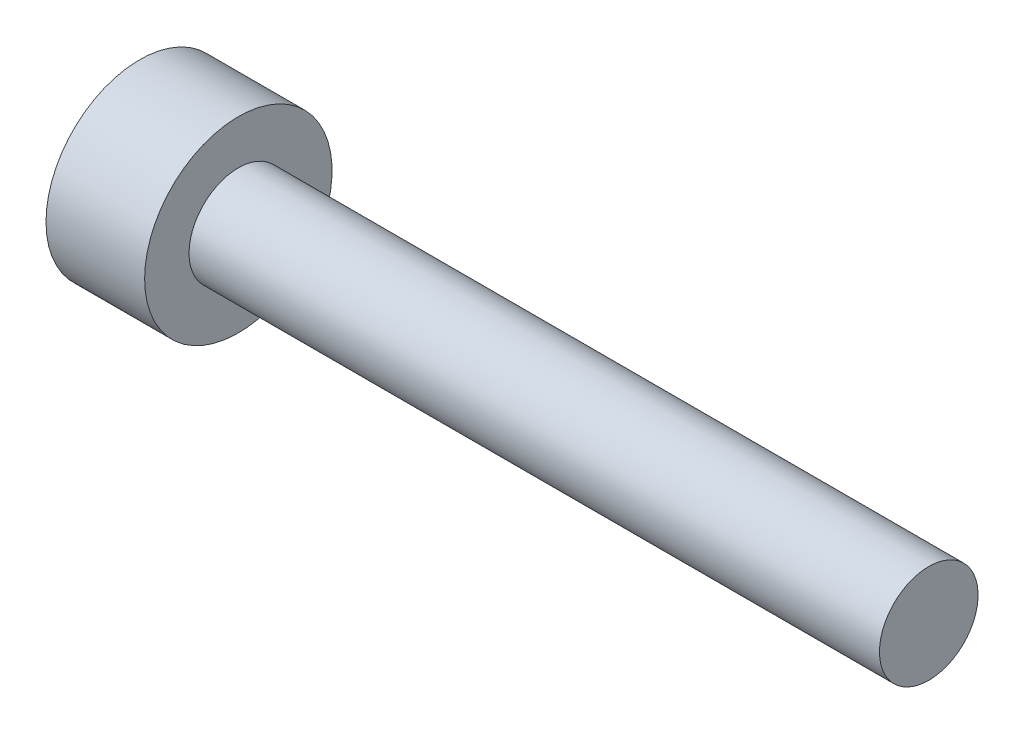
from build123d import *

# Parameters (mm, degrees)
SOCKET_DEPTH = 1


with BuildPart() as part:
    # Screw Sketch → Screw (revolve)
    with BuildSketch(Plane.XY):
        Polygon((-2, 0), (-2, 1.9), (0, 1.9), (0, 1), (14, 1), (14, 0), align=None)
    revolve(axis=Axis((-1000, 0, 0), (1, 0, 0)))

    # Socket Sketch → Socket (cut)
    with BuildSketch(Plane(origin=(-2, 0, 0), x_dir=(0, 0, -1), z_dir=(1, 0, 0))):
        Polygon((0.866025404, 0), (0.433012702, 0.75), (-0.433012702, 0.75), (-0.866025404, 0), (-0.433012702, -0.75), (0.433012702, -0.75), align=None)
    extrude(amount=SOCKET_DEPTH, mode=Mode.SUBTRACT)


solid = part.part
